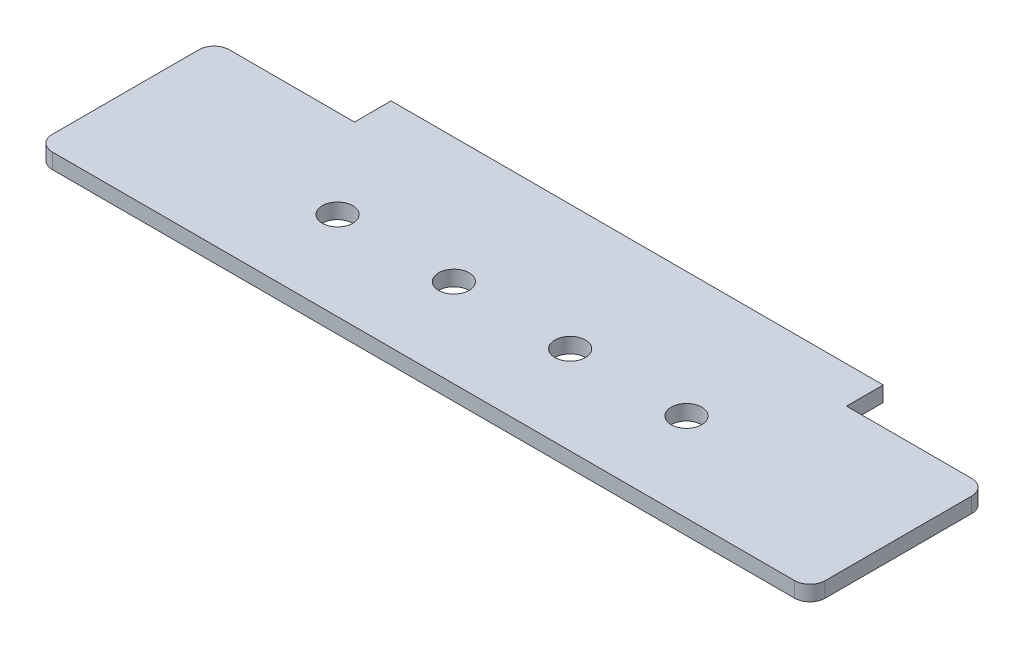
from build123d import *

# Parameters (mm, degrees)
SKETCH1_R           = 0.5
BOSS_EXTRUDE1_DEPTH = 0.5


with BuildPart() as part:
    # Sketch1 → Boss-Extrude1 (new body)
    with BuildSketch(Plane(origin=(0, 0, 0), x_dir=(1, 0, 0), z_dir=(0, 1, 0))):
        with BuildLine():
            Line((13.775, 2.9), (17.875, 2.9))
            ThreePointArc((17.875, 2.9), (18.228553391, 2.753553391), (18.375, 2.4))
            Line((18.375, 2.4), (18.375, -2.4))
            ThreePointArc((18.375, -2.4), (18.228553391, -2.753553391), (17.875, -2.9))
            Line((17.875, -2.9), (-6.445, -2.9))
            ThreePointArc((-6.445, -2.9), (-6.798553391, -2.753553391), (-6.945, -2.4))
            Line((-6.945, -2.4), (-6.945, 2.4))
            ThreePointArc((-6.945, 2.4), (-6.798553391, 2.753553391), (-6.445, 2.9))
            Line((-6.445, 2.9), (-2.345, 2.9))
            Line((-2.345, 2.9), (-2.345, 4.1))
            Line((-2.345, 4.1), (13.775, 4.1))
            Line((13.775, 4.1), (13.775, 2.9))
        make_face()
        with Locations(Location((0, 0, 0), (0, 0, 270))):
            Circle(SKETCH1_R, mode=Mode.SUBTRACT)
        with Locations(Location((3.81, 0, 0), (0, 0, 270))):
            Circle(SKETCH1_R, mode=Mode.SUBTRACT)
        with Locations(Location((7.62, 0, 0), (0, 0, 270))):
            Circle(SKETCH1_R, mode=Mode.SUBTRACT)
        with Locations(Location((11.43, 0, 0), (0, 0, 270))):
            Circle(SKETCH1_R, mode=Mode.SUBTRACT)
    extrude(amount=BOSS_EXTRUDE1_DEPTH)


solid = part.part
